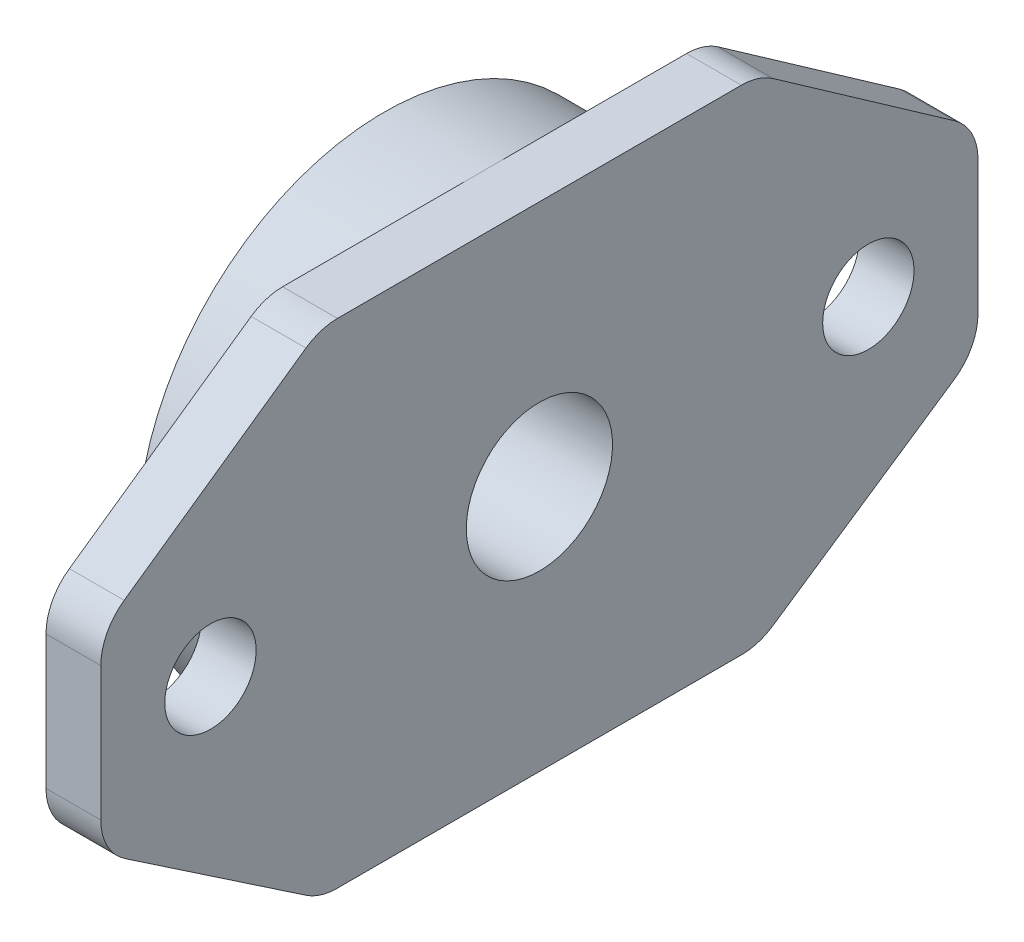
from build123d import *

# Parameters (mm, degrees)
SKETCH_1_W          = 48
SKETCH_1_H          = 27
EXTRUDE_1_DEPTH     = 3
SKETCH_5_R          = 13.5
EXTRUDE_2_DEPTH     = 5.5
SKETCH_6_R          = 5
EXTRUDE_3_DEPTH     = 4.5
SKETCH_7_R          = 4
CUT_EXTRUDE_1_DEPTH = 57.586217403
SKETCH_8_R          = 2.5
CUT_EXTRUDE_2_DEPTH = 56.973207877
CUT_EXTRUDE_3_DEPTH = 56.973207877
FILLET_1_R          = 3


with BuildPart() as part:
    # 草图1 → 凸台-拉伸1 (new body)
    with BuildSketch(Plane(origin=(0, 0, 0), x_dir=(0, 0, -1), z_dir=(1, 0, 0))):
        with Locations((24, 13.5)):
            Rectangle(SKETCH_1_W, SKETCH_1_H)
    extrude(amount=EXTRUDE_1_DEPTH)

    # 草图5 → 凸台-拉伸2 (add)
    with BuildSketch(Plane.ZY):
        with Locations(Location((-24, 13.5, 0), (0, 0, 270))):
            Circle(SKETCH_5_R)
    extrude(amount=EXTRUDE_2_DEPTH)

    # 草图6 → 凸台-拉伸3 (add)
    with BuildSketch(Plane.ZY.offset(5.5)):
        with Locations((-24, 13.5)):
            Circle(SKETCH_6_R)
    extrude(amount=EXTRUDE_3_DEPTH)

    # 草图7 → 切除-拉伸1 (cut, through all)
    with BuildSketch(Plane.ZY.offset(10)):
        with Locations((-24, 13.5)):
            Circle(SKETCH_7_R)
    extrude(amount=-CUT_EXTRUDE_1_DEPTH, mode=Mode.SUBTRACT)

    # 草图8 → 切除-拉伸2 (cut, through all)
    with BuildSketch(Plane.ZY):
        with Locations((-42, 13.5)):
            Circle(SKETCH_8_R)
        with Locations((-6, 13.5)):
            Circle(SKETCH_8_R)
    extrude(amount=-CUT_EXTRUDE_2_DEPTH, mode=Mode.SUBTRACT)

    # 草图9 → 切除-拉伸3 (cut, through all)
    with BuildSketch(Plane.ZY):
        Polygon((-36, 27), (-48, 18.580800232), (-48, 27), align=None)
        Polygon((-12, 27), (0, 18.580800232), (0, 27), align=None)
        Polygon((0, 0), (-12, 0), (0, 8.106535138), align=None)
        Polygon((-48, 0), (-48, 8.106535138), (-36, 0), align=None)
    extrude(amount=-CUT_EXTRUDE_3_DEPTH, mode=Mode.SUBTRACT)

    # 圆角1
    fillet_1_edges = [part.edges().sort_by_distance(p)[0] for p in [
        (1.5, 27, -36),
        (1.5, 18.580800232, -48),
        (1.5, 27, -12),
        (1.5, 18.580800232, 0),
        (1.5, 8.106535138, 0),
        (1.5, 0, -12),
        (1.5, 0, -36),
        (1.5, 8.106535138, -48),
    ]]
    fillet(fillet_1_edges, radius=FILLET_1_R)


solid = part.part
